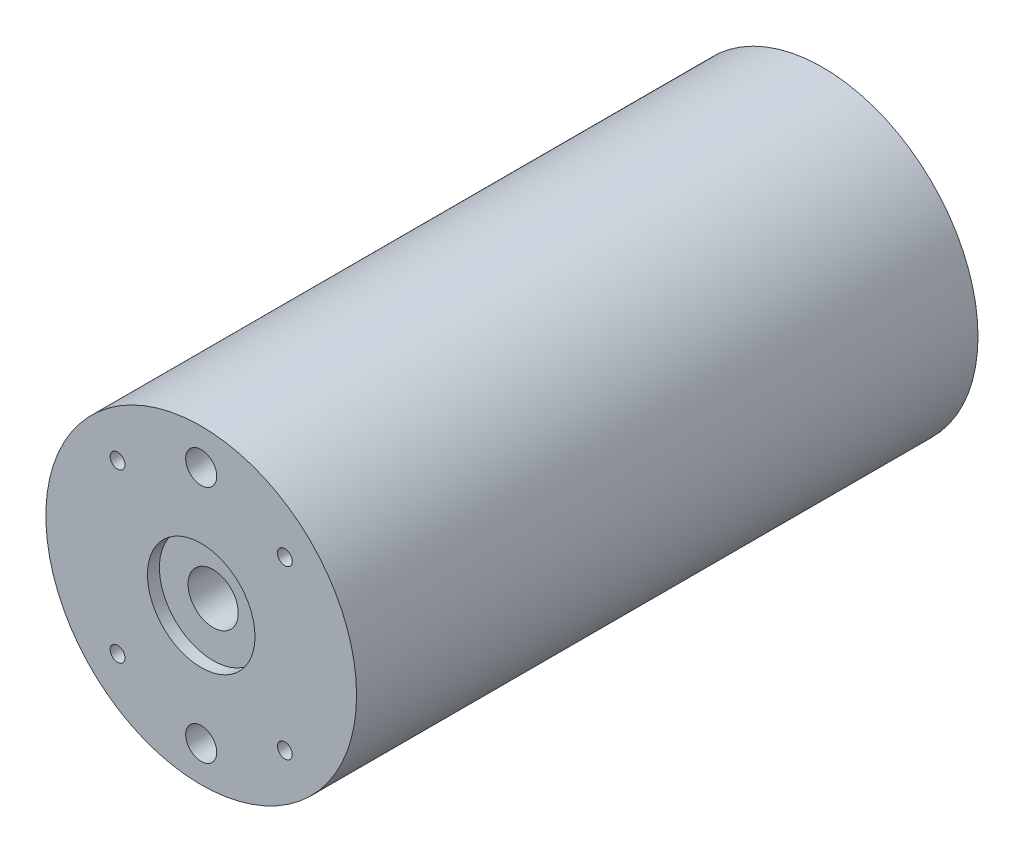
from build123d import *

# Parameters (mm, degrees)
SKETCH1_R           = 41.275
BOSS_EXTRUDE1_DEPTH = 165.1
SKETCH2_R           = 14.2875
CUT_EXTRUDE1_DEPTH  = 3.175
SKETCH3_R           = 6.6675
CUT_EXTRUDE2_DEPTH  = 12.7
SKETCH4_R           = 4.1275
CUT_EXTRUDE3_DEPTH  = 9.525
SKETCH5_R           = 1.9685
CUT_EXTRUDE4_DEPTH  = 19.05
CUT_EXTRUDE5_START  = -3.175
SKETCH6_R           = 14.2875
CUT_EXTRUDE5_DEPTH  = 3.175


with BuildPart() as part:
    # Sketch1 → Boss-Extrude1 (new body)
    with BuildSketch(Plane.XY):
        Circle(SKETCH1_R)
    extrude(amount=BOSS_EXTRUDE1_DEPTH)

    # Sketch2 → Cut-Extrude1 (cut)
    with BuildSketch(Plane.XY.offset(165.1)):
        Circle(SKETCH2_R)
    extrude(amount=-CUT_EXTRUDE1_DEPTH, mode=Mode.SUBTRACT)

    # Sketch3 → Cut-Extrude2 (cut)
    with BuildSketch(Plane.XY.offset(161.925)):
        Circle(SKETCH3_R)
    extrude(amount=-CUT_EXTRUDE2_DEPTH, mode=Mode.SUBTRACT)

    # Sketch4 → Cut-Extrude3 (cut)
    with BuildSketch(Plane.XY.offset(165.1)):
        with Locations((0, 31.75)):
            Circle(SKETCH4_R)
        with Locations((0, -31.75)):
            Circle(SKETCH4_R)
    extrude(amount=-CUT_EXTRUDE3_DEPTH, mode=Mode.SUBTRACT)

    # Sketch5 → Cut-Extrude4 (cut)
    with BuildSketch(Plane.XY.offset(165.1)):
        with Locations((-22.225, 22.225)):
            Circle(SKETCH5_R)
        with Locations((-22.225, -22.225)):
            Circle(SKETCH5_R)
        with Locations((22.225, -22.225)):
            Circle(SKETCH5_R)
        with Locations((22.225, 22.225)):
            Circle(SKETCH5_R)
    extrude(amount=-CUT_EXTRUDE4_DEPTH, mode=Mode.SUBTRACT)

    # Sketch6 → Cut-Extrude5 (cut)
    with BuildSketch(Plane(origin=(0, 0, 0), x_dir=(-1, 0, 0), z_dir=(0, 0, -1)).offset(CUT_EXTRUDE5_START)):
        with Locations(Location((0, 0, 0), (0, 0, 180))):
            Circle(SKETCH6_R)
    extrude(amount=CUT_EXTRUDE5_DEPTH, mode=Mode.SUBTRACT)


solid = part.part
